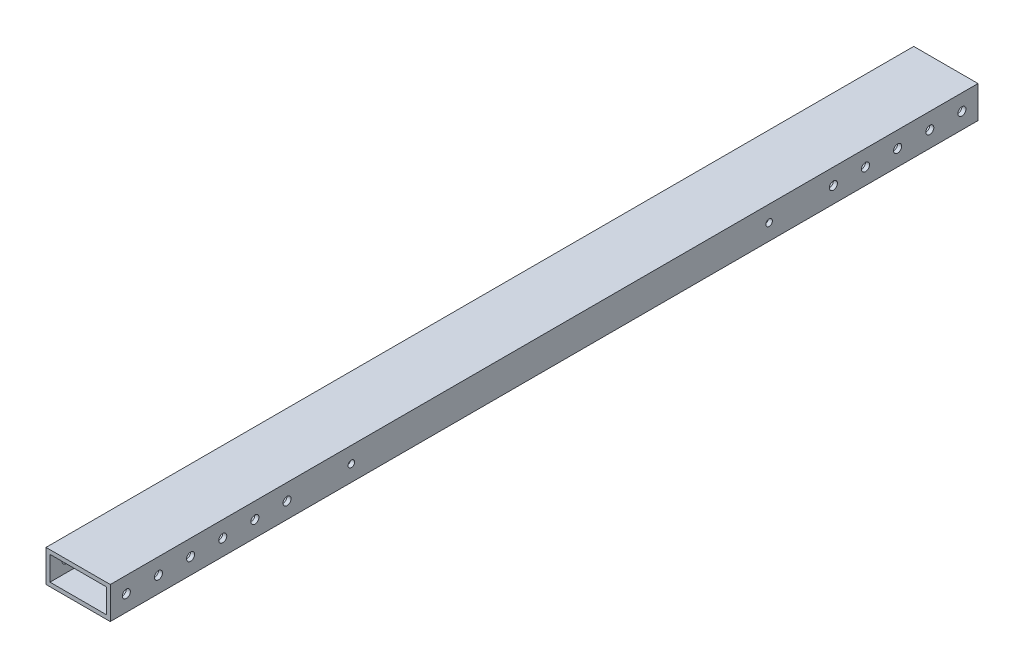
from build123d import *

# Parameters (mm, degrees)
BOSS_EXTRUDE1_DEPTH              = 342.9
BOSS_EXTRUDE1_DEPTH_BACK         = 342.9
SKETCH3_W                        = 50.8
SKETCH3_H                        = 25.4
SKETCH3_W_2                      = 44.45
SKETCH3_H_2                      = 19.05
F_1_4_0_25_DIAMETER_HOLE3_D      = 6.35
F_1_4_0_25_DIAMETER_HOLE4_D      = 6.35
F_1_4_0_25_DIAMETER_HOLE5_D      = 6.35
F_1_4_0_25_DIAMETER_HOLE6_D      = 6.35
F_1_4_0_25_DIAMETER_HOLE7_D      = 6.35
F_1_4_0_25_DIAMETER_HOLE8_D      = 6.35
F_13_64_0_20313_DIAMETER_HOLE1_D = 5.159502
F_1_2_0_5_DIAMETER_HOLE1_D       = 12.7
F_1_2_0_5_DIAMETER_HOLE1_DEPTH   = 6.35
F_1_2_0_5_DIAMETER_HOLE1_TIP     = 3.815464931


with BuildPart() as part:
    # Sketch3 → Boss-Extrude1 (new, two sides: drawn at the far end of the back side and taken through both)
    with BuildSketch(Plane.XY.offset(-BOSS_EXTRUDE1_DEPTH_BACK)):
        Rectangle(SKETCH3_W, SKETCH3_H)
        Rectangle(SKETCH3_W_2, SKETCH3_H_2, mode=Mode.SUBTRACT)
    extrude(amount=BOSS_EXTRUDE1_DEPTH + BOSS_EXTRUDE1_DEPTH_BACK)

    # 1/4 (0.25) Diameter Hole3 (through all)
    with Locations(Plane.ZY.offset(25.4)):
        with Locations((-330.2, 0)):
            Hole(F_1_4_0_25_DIAMETER_HOLE3_D / 2)

    # 1/4 (0.25) Diameter Hole4 (through all)
    with Locations(Plane.ZY.offset(25.4)):
        with Locations((304.8, 0), (330.2, 0)):
            Hole(F_1_4_0_25_DIAMETER_HOLE4_D / 2)

    # 1/4 (0.25) Diameter Hole5 (through all)
    with Locations(Plane(origin=(25.4, 0, 0), x_dir=(0, 0, -1), z_dir=(1, 0, 0))):
        with Locations((304.8, 0), (279.4, 0)):
            Hole(F_1_4_0_25_DIAMETER_HOLE5_D / 2)

    # 1/4 (0.25) Diameter Hole6 (through all)
    with Locations(Plane(origin=(25.4, 0, 0), x_dir=(0, 0, -1), z_dir=(1, 0, 0))):
        with Locations((228.6, 0), (254, 0)):
            Hole(F_1_4_0_25_DIAMETER_HOLE6_D / 2)

    # 1/4 (0.25) Diameter Hole7 (through all)
    with Locations(Plane(origin=(25.4, 0, 0), x_dir=(0, 0, -1), z_dir=(1, 0, 0))):
        with Locations((-203.2, 0), (-228.6, 0)):
            Hole(F_1_4_0_25_DIAMETER_HOLE7_D / 2)

    # 1/4 (0.25) Diameter Hole8 (through all)
    with Locations(Plane(origin=(25.4, 0, 0), x_dir=(0, 0, -1), z_dir=(1, 0, 0))):
        with Locations((-279.4, 0), (-254, 0)):
            Hole(F_1_4_0_25_DIAMETER_HOLE8_D / 2)

    # 13/64 (0.20313) Diameter Hole1 (through all)
    with Locations(Plane(origin=(25.4, 0, 0), x_dir=(0, 0, -1), z_dir=(1, 0, 0))):
        with Locations((-152.4, 0), (177.8, 0)):
            Hole(F_13_64_0_20313_DIAMETER_HOLE1_D / 2)

    # 1/2 (0.5) Diameter Hole1
    with Locations(Plane.ZY.offset(25.4)):
        with Locations((-591.301639708, -480.802221962), (-103.1875, 0), (77.7875, 0), (103.1875, 0), (-128.5875, 0)):
            Hole(F_1_2_0_5_DIAMETER_HOLE1_D / 2, depth=F_1_2_0_5_DIAMETER_HOLE1_DEPTH)
            with Locations((0, 0, -(F_1_2_0_5_DIAMETER_HOLE1_DEPTH + F_1_2_0_5_DIAMETER_HOLE1_TIP / 2))):  # 118° drill point
                Cone(0, F_1_2_0_5_DIAMETER_HOLE1_D / 2, F_1_2_0_5_DIAMETER_HOLE1_TIP, mode=Mode.SUBTRACT)


solid = part.part
